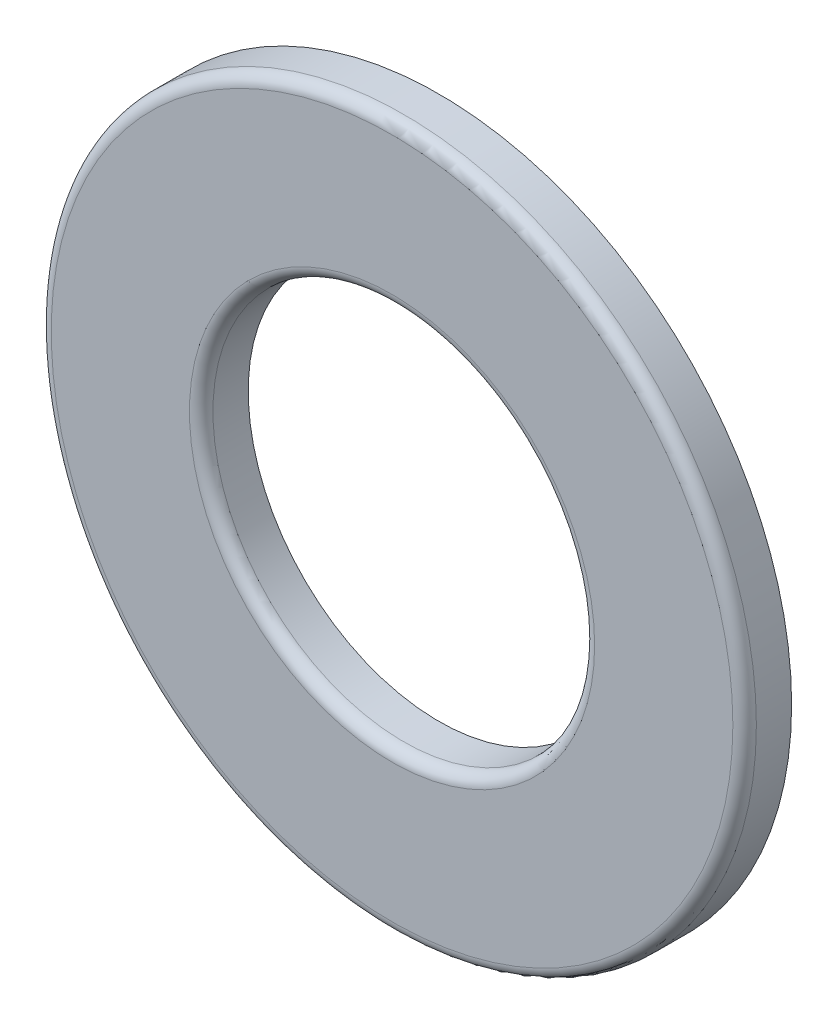
from build123d import *

# Parameters (mm, degrees)
BOSS_EXTRUDE1_DEPTH      = 0.635
BOSS_EXTRUDE1_DEPTH_BACK = 0.635
SKETCH3_R                = 9.525
SKETCH3_R_2              = 5.1562
FILLET1_R                = 0.3175


with BuildPart() as part:
    # Sketch3 → Boss-Extrude1 (new, two sides: drawn at the far end of the back side and taken through both)
    with BuildSketch(Plane.XY.offset(-BOSS_EXTRUDE1_DEPTH_BACK)):
        Circle(SKETCH3_R)
        Circle(SKETCH3_R_2, mode=Mode.SUBTRACT)
    extrude(amount=BOSS_EXTRUDE1_DEPTH + BOSS_EXTRUDE1_DEPTH_BACK)

    # Fillet1
    fillet1_edges = [part.edges().sort_by_distance(p)[0] for p in [
        (-9.525, 0, 0.635),
        (-5.1562, 0, 0.635),
    ]]
    fillet(fillet1_edges, radius=FILLET1_R)


solid = part.part
